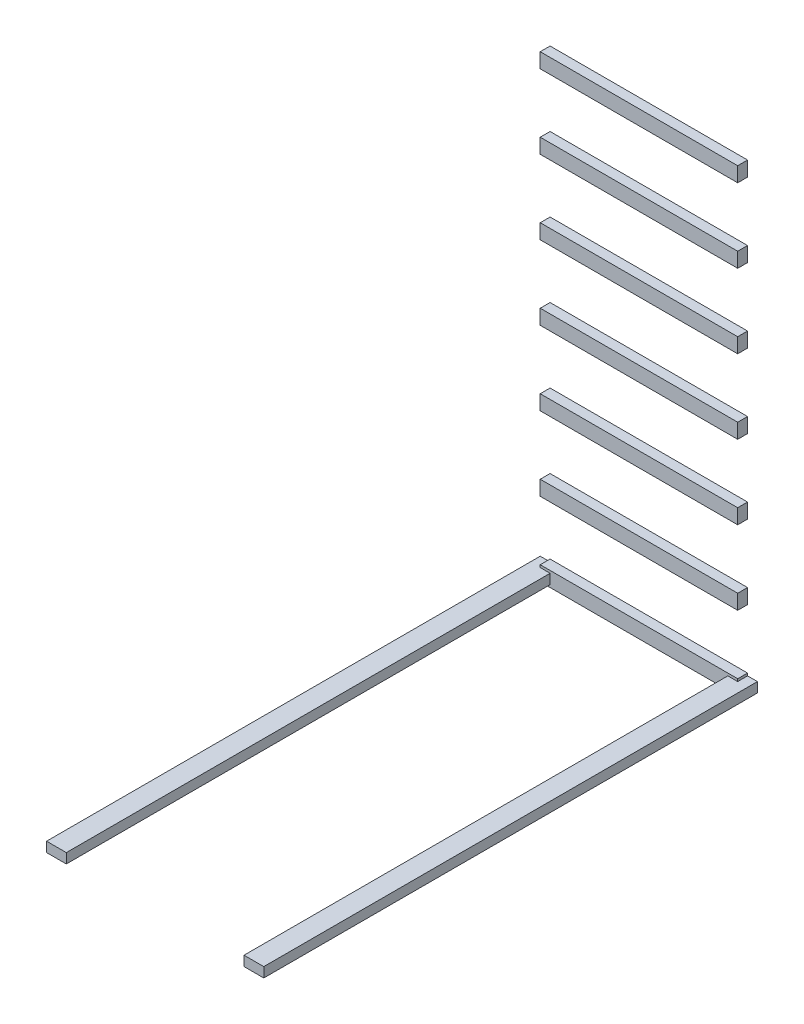
from build123d import *

# Parameters (mm, degrees)
SKETCH_1_W      = 80
SKETCH_1_H      = 40
EXTRUDE_1_DEPTH = 2000
SKETCH_2_W      = 80
SKETCH_2_H      = 40
EXTRUDE_2_DEPTH = 2000
SKETCH_3_W      = 800
SKETCH_3_H      = 60
EXTRUDE_3_DEPTH = 40
SKETCH_4_W      = 800
SKETCH_4_H      = 60
EXTRUDE_4_DEPTH = 40
SKETCH_5_W      = 800
SKETCH_5_H      = 60
EXTRUDE_5_DEPTH = 40
SKETCH_6_W      = 800
SKETCH_6_H      = 60
EXTRUDE_6_DEPTH = 40
SKETCH_7_W      = 800
SKETCH_7_H      = 60
EXTRUDE_7_DEPTH = 40
SKETCH_8_W      = 800
SKETCH_8_H      = 60
EXTRUDE_8_DEPTH = 40
SKETCH_9_W      = 800
SKETCH_9_H      = 60
EXTRUDE_9_DEPTH = 40


with BuildPart() as part:
    # 草图1 → 凸台-拉伸1 (new body)
    with BuildSketch(Plane.XY):
        with Locations((-400, 0)):
            Rectangle(SKETCH_1_W, SKETCH_1_H)
    extrude(amount=EXTRUDE_1_DEPTH)



with BuildPart() as body_2:
    # 草图2 → 凸台-拉伸2 (new body)
    with BuildSketch(Plane.XY):
        with Locations((400, 0)):
            Rectangle(SKETCH_2_W, SKETCH_2_H)
    extrude(amount=EXTRUDE_2_DEPTH)


with BuildPart() as part_1:
    add(part.part)

    add(body_2.part)  # 凸台-拉伸3 merges body 2
    # 草图3 → 凸台-拉伸3 (add)
    with BuildSketch(Plane.XY):
        Rectangle(SKETCH_3_W, SKETCH_3_H)
    extrude(amount=EXTRUDE_3_DEPTH)


with BuildPart() as body_2_2:
    # 草图4 → 凸台-拉伸4 (new body)
    with BuildSketch(Plane.XY):
        with Locations((0, 300)):
            Rectangle(SKETCH_4_W, SKETCH_4_H)
    extrude(amount=EXTRUDE_4_DEPTH)


with BuildPart() as body_3:
    # 草图5 → 凸台-拉伸5 (new body)
    with BuildSketch(Plane.XY):
        with Locations((0, 600)):
            Rectangle(SKETCH_5_W, SKETCH_5_H)
    extrude(amount=EXTRUDE_5_DEPTH)


with BuildPart() as body_4:
    # 草图6 → 凸台-拉伸6 (new body)
    with BuildSketch(Plane.XY):
        with Locations((0, 900)):
            Rectangle(SKETCH_6_W, SKETCH_6_H)
    extrude(amount=EXTRUDE_6_DEPTH)


with BuildPart() as body_5:
    # 草图7 → 凸台-拉伸7 (new body)
    with BuildSketch(Plane.XY):
        with Locations((0, 1200)):
            Rectangle(SKETCH_7_W, SKETCH_7_H)
    extrude(amount=EXTRUDE_7_DEPTH)


with BuildPart() as body_6:
    # 草图8 → 凸台-拉伸8 (new body)
    with BuildSketch(Plane.XY):
        with Locations((0, 1500)):
            Rectangle(SKETCH_8_W, SKETCH_8_H)
    extrude(amount=EXTRUDE_8_DEPTH)


with BuildPart() as body_7:
    # 草图9 → 凸台-拉伸9 (new body)
    with BuildSketch(Plane.XY):
        with Locations((0, 1800)):
            Rectangle(SKETCH_9_W, SKETCH_9_H)
    extrude(amount=EXTRUDE_9_DEPTH)


solid = Compound([part_1.part, body_2_2.part, body_3.part, body_4.part, body_5.part, body_6.part, body_7.part])
